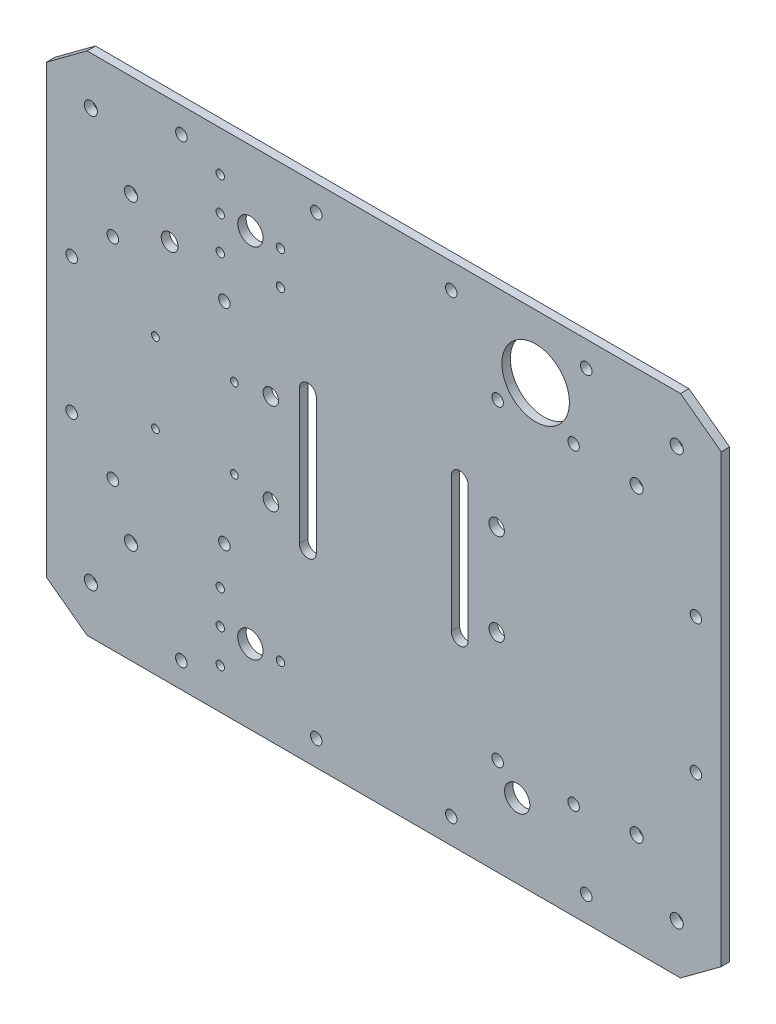
from build123d import *

# Parameters (mm, degrees)
SKETCH1_R           = 2.4638
BOSS_EXTRUDE1_DEPTH = 3.175
SKETCH2_R           = 2.159
CUT_EXTRUDE1_DEPTH  = 159.781746826
SKETCH5_R           = 12.7
SKETCH5_R_2         = 3.175
SKETCH5_R_3         = 2.159
SKETCH5_R_4         = 1.4478
CUT_EXTRUDE2_DEPTH  = 159.781746826
SKETCH6_R           = 2.159
CUT_EXTRUDE3_DEPTH  = 159.781746826
SKETCH5_3_R         = 2.9083
CUT_EXTRUDE4_DEPTH  = 159.781746826
SKETCH5_4_R         = 1.5875
SKETCH5_4_R_2       = 4.7625
CUT_EXTRUDE5_DEPTH  = 159.781746826
SKETCH5_5_R         = 1.5875
CUT_EXTRUDE6_DEPTH  = 2.54
SKETCH5_6_R         = 1.5875
CUT_EXTRUDE7_DEPTH  = 159.781746826


with BuildPart() as part:
    # Sketch1 → Boss-Extrude1 (new body)
    with BuildSketch(Plane.XY):
        Polygon((-111.686526805, -95.25), (-127, -83.918625912), (-127, 83.918625912), (-111.686526805, 95.25), (111.686526805, 95.25), (127, 83.918625912), (127, -83.918625912), (111.686526805, -95.25), align=None)
        with Locations((-95.147512794, 56.885632681)):
            Circle(SKETCH1_R, mode=Mode.SUBTRACT)
        with Locations((-110.256011578, 77.303596941)):
            Circle(SKETCH1_R, mode=Mode.SUBTRACT)
        with Locations((110.256011578, 77.303596941)):
            Circle(SKETCH1_R, mode=Mode.SUBTRACT)
        with Locations((95.147512794, 56.885632681)):
            Circle(SKETCH1_R, mode=Mode.SUBTRACT)
        with Locations((-110.256011578, -77.303596941)):
            Circle(SKETCH1_R, mode=Mode.SUBTRACT)
        with Locations((-95.147512794, -56.885632681)):
            Circle(SKETCH1_R, mode=Mode.SUBTRACT)
        with Locations((110.256011578, -77.303596941)):
            Circle(SKETCH1_R, mode=Mode.SUBTRACT)
        with Locations((95.147512794, -56.885632681)):
            Circle(SKETCH1_R, mode=Mode.SUBTRACT)
    extrude(amount=BOSS_EXTRUDE1_DEPTH)

    # Sketch2 → Cut-Extrude1 (cut, through all)
    with BuildSketch(Plane.XY.offset(3.175)):
        with Locations((42.8625, 58.7375)):
            Circle(SKETCH2_R)
        with Locations((42.8625, -58.7375)):
            Circle(SKETCH2_R)
        with Locations((71.4375, -58.7375)):
            Circle(SKETCH2_R)
        with Locations((71.4375, 58.7375)):
            Circle(SKETCH2_R)
    extrude(amount=-CUT_EXTRUDE1_DEPTH, mode=Mode.SUBTRACT)

    # Sketch5 → Cut-Extrude2 (cut, through all)
    with BuildSketch(Plane(origin=(0, 0, 0), x_dir=(-1, 0, 0), z_dir=(0, 0, -1))):
        with Locations((-57.15, 71.4375)):
            Circle(SKETCH5_R)
        with Locations((80.594630637, 48.58004)):
            Circle(SKETCH5_R_2)
        with Locations((59.995230637, -39.49954)):
            Circle(SKETCH5_R_3)
        with Locations((101.994130637, -39.49954)):
            Circle(SKETCH5_R_3)
        with Locations((101.994130637, 39.49954)):
            Circle(SKETCH5_R_3)
        with Locations((59.995230637, 39.49954)):
            Circle(SKETCH5_R_3)
        with BuildLine():
            Line((-31.75, 25.4), (-31.75, -25.4))
            ThreePointArc((-31.75, -25.4), (-28.575, -28.575), (-25.4, -25.4))
            Line((-25.4, -25.4), (-25.4, 25.4))
            ThreePointArc((-25.4, 25.4), (-28.575, 28.575), (-31.75, 25.4))
        make_face()
        with Locations((85.937708857, 15.03413)):
            Circle(SKETCH5_R_4)
        with Locations((56.219708857, 15.03413)):
            Circle(SKETCH5_R_4)
        with Locations((56.219708857, -15.03413)):
            Circle(SKETCH5_R_4)
        with Locations((85.937708857, -15.03413)):
            Circle(SKETCH5_R_4)
        with BuildLine():
            ThreePointArc((31.75, 25.4), (28.575, 28.575), (25.4, 25.4))
            Line((25.4, 25.4), (25.4, -25.4))
            ThreePointArc((25.4, -25.4), (28.575, -28.575), (31.75, -25.4))
            Line((31.75, -25.4), (31.75, 25.4))
        make_face()
    extrude(amount=-CUT_EXTRUDE2_DEPTH, mode=Mode.SUBTRACT)

    # Sketch6 → Cut-Extrude3 (cut, through all)
    with BuildSketch(Plane(origin=(0, 0, 0), x_dir=(-1, 0, 0), z_dir=(0, 0, -1))):
        with Locations((-76.2, -85.725)):
            Circle(SKETCH6_R)
        with Locations((-25.4, -85.725)):
            Circle(SKETCH6_R)
        with Locations((25.4, -85.725)):
            Circle(SKETCH6_R)
        with Locations((76.2, -85.725)):
            Circle(SKETCH6_R)
        with Locations((76.2, 85.725)):
            Circle(SKETCH6_R)
        with Locations((25.4, 85.725)):
            Circle(SKETCH6_R)
        with Locations((-25.4, 85.725)):
            Circle(SKETCH6_R)
        with Locations((-76.2, 85.725)):
            Circle(SKETCH6_R)
        with Locations((117.475, -25.4)):
            Circle(SKETCH6_R)
        with Locations((117.475, 25.4)):
            Circle(SKETCH6_R)
        with Locations((-117.475, 25.4)):
            Circle(SKETCH6_R)
        with Locations((-117.475, -25.4)):
            Circle(SKETCH6_R)
    extrude(amount=-CUT_EXTRUDE3_DEPTH, mode=Mode.SUBTRACT)

    # Sketch5<3> → Cut-Extrude4 (cut, through all)
    with BuildSketch(Plane(origin=(0, 0, 0), x_dir=(-1, 0, 0), z_dir=(0, 0, -1))):
        with Locations((-42.5, 17.2)):
            Circle(SKETCH5_3_R)
        with Locations((-42.5, -17.2)):
            Circle(SKETCH5_3_R)
        with Locations((42.5, -17.2)):
            Circle(SKETCH5_3_R)
        with Locations((42.5, 17.2)):
            Circle(SKETCH5_3_R)
    extrude(amount=-CUT_EXTRUDE4_DEPTH, mode=Mode.SUBTRACT)

    # Sketch5<4> → Cut-Extrude5 (cut, through all)
    with BuildSketch(Plane(origin=(0, 0, 0), x_dir=(-1, 0, 0), z_dir=(0, 0, -1))):
        with Locations((61.544630637, -54.61)):
            Circle(SKETCH5_4_R)
        with Locations((61.544630637, -67.31)):
            Circle(SKETCH5_4_R)
        with Locations((61.544630637, 54.61)):
            Circle(SKETCH5_4_R)
        with Locations((61.544630637, -80.01)):
            Circle(SKETCH5_4_R)
        with Locations((-50.215369363, -67.31)):
            Circle(SKETCH5_4_R_2)
        with Locations((50.215369363, -67.31)):
            Circle(SKETCH5_4_R_2)
        with Locations((61.544630637, 67.31)):
            Circle(SKETCH5_4_R)
        with Locations((61.544630637, 80.01)):
            Circle(SKETCH5_4_R)
        with Locations((50.215369363, 67.31)):
            Circle(SKETCH5_4_R_2)
    extrude(amount=-CUT_EXTRUDE5_DEPTH, mode=Mode.SUBTRACT)

    # Sketch5<5> → Cut-Extrude6 (cut)
    with BuildSketch(Plane(origin=(0, 0, 0), x_dir=(-1, 0, 0), z_dir=(0, 0, -1))):
        with Locations((38.886108088, 67.31)):
            Circle(SKETCH5_5_R)
        with Locations((38.886108088, 54.61)):
            Circle(SKETCH5_5_R)
        with Locations((38.886108088, -67.31)):
            Circle(SKETCH5_5_R)
    extrude(amount=-CUT_EXTRUDE6_DEPTH, mode=Mode.SUBTRACT)

    # Sketch5<6> → Cut-Extrude7 (cut, through all)
    with BuildSketch(Plane(origin=(0, 0, 0), x_dir=(-1, 0, 0), z_dir=(0, 0, -1))):
        with Locations((38.886108088, 67.31)):
            Circle(SKETCH5_6_R)
        with Locations((38.886108088, 54.61)):
            Circle(SKETCH5_6_R)
        with Locations((38.886108088, -67.31)):
            Circle(SKETCH5_6_R)
    extrude(amount=-CUT_EXTRUDE7_DEPTH, mode=Mode.SUBTRACT)


solid = part.part
